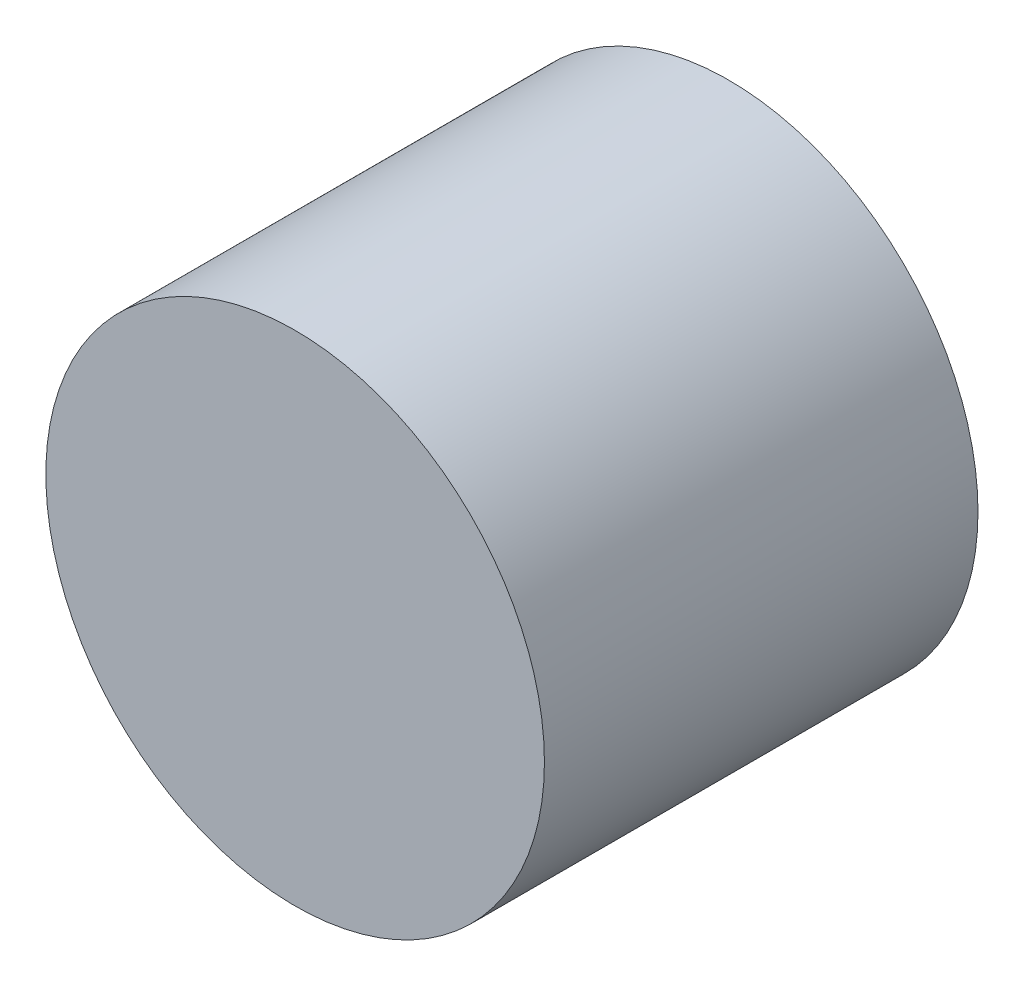
from build123d import *

# Parameters (mm, degrees)
CROQUIS1_R              = 5.75
SALIENTE_EXTRUIR1_DEPTH = 10


with BuildPart() as part:
    # Croquis1 → Saliente-Extruir1 (new body)
    with BuildSketch(Plane.XY):
        Circle(CROQUIS1_R)
    extrude(amount=SALIENTE_EXTRUIR1_DEPTH)


solid = part.part
